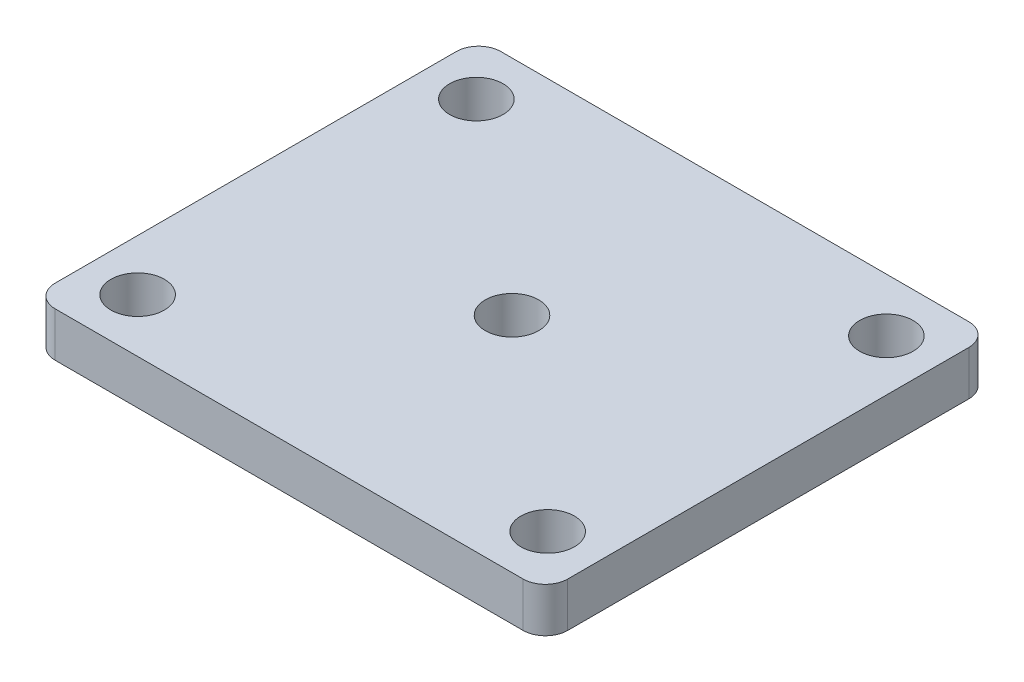
from build123d import *

# Parameters (mm, degrees)
SKETCH1_W           = 115
SKETCH1_H           = 100
SKETCH1_R           = 6
BOSS_EXTRUDE2_DEPTH = 10
FILLET1_R           = 5


with BuildPart() as part:
    # Sketch1 → Boss-Extrude2 (new body)
    with BuildSketch(Plane(origin=(0, 0, 0), x_dir=(1, 0, 0), z_dir=(0, 1, 0))):
        Rectangle(SKETCH1_W, SKETCH1_H)
        with Locations(Location((-46, 38, 0), (0, 0, 270))):
            Circle(SKETCH1_R, mode=Mode.SUBTRACT)
        with Locations(Location((46, 38, 0), (0, 0, 270))):
            Circle(SKETCH1_R, mode=Mode.SUBTRACT)
        with Locations(Location((46, -38, 0), (0, 0, 270))):
            Circle(SKETCH1_R, mode=Mode.SUBTRACT)
        with Locations(Location((-46, -38, 0), (0, 0, 270))):
            Circle(SKETCH1_R, mode=Mode.SUBTRACT)
        with Locations(Location((0, 0, 0), (0, 0, 270))):
            Circle(SKETCH1_R, mode=Mode.SUBTRACT)
    extrude(amount=BOSS_EXTRUDE2_DEPTH)

    # Fillet1
    fillet1_edges = [part.edges().sort_by_distance(p)[0] for p in [
        (-57.5, 5, -50),
        (57.5, 5, -50),
        (57.5, 5, 50),
        (-57.5, 5, 50),
    ]]
    fillet(fillet1_edges, radius=FILLET1_R)


solid = part.part
